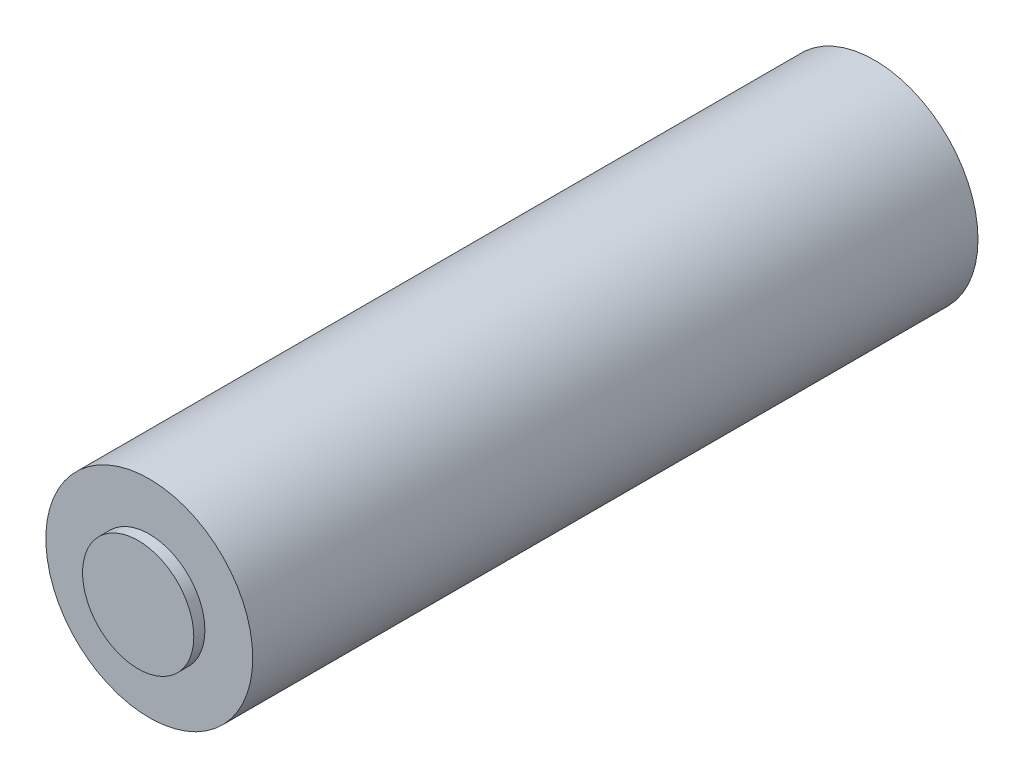
from build123d import *

# Parameters (mm, degrees)
SKETCH1_R           = 9.3
BOSS_EXTRUDE1_DEPTH = 65.2
SKETCH2_R           = 5
BOSS_EXTRUDE2_DEPTH = 1


with BuildPart() as part:
    # Sketch1 → Boss-Extrude1 (new body)
    with BuildSketch(Plane.XY):
        Circle(SKETCH1_R)
    extrude(amount=BOSS_EXTRUDE1_DEPTH)

    # Sketch2 → Boss-Extrude2 (add)
    with BuildSketch(Plane.XY.offset(65.2)):
        Circle(SKETCH2_R)
    extrude(amount=BOSS_EXTRUDE2_DEPTH)


solid = part.part
